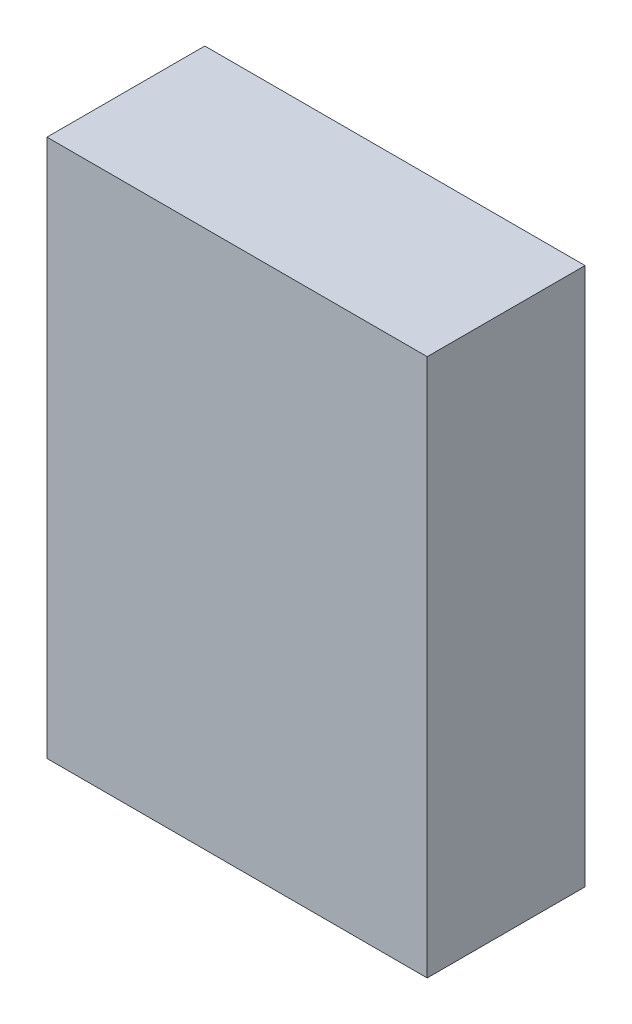
from build123d import *

# Parameters (mm, degrees)
SKETCH1_W      = 53
SKETCH1_H      = 75
ENVELOPE_DEPTH = 22


with BuildPart() as part:
    # Sketch1 → Envelope (new body)
    with BuildSketch(Plane.XY):
        Rectangle(SKETCH1_W, SKETCH1_H)
    extrude(amount=ENVELOPE_DEPTH)


solid = part.part
